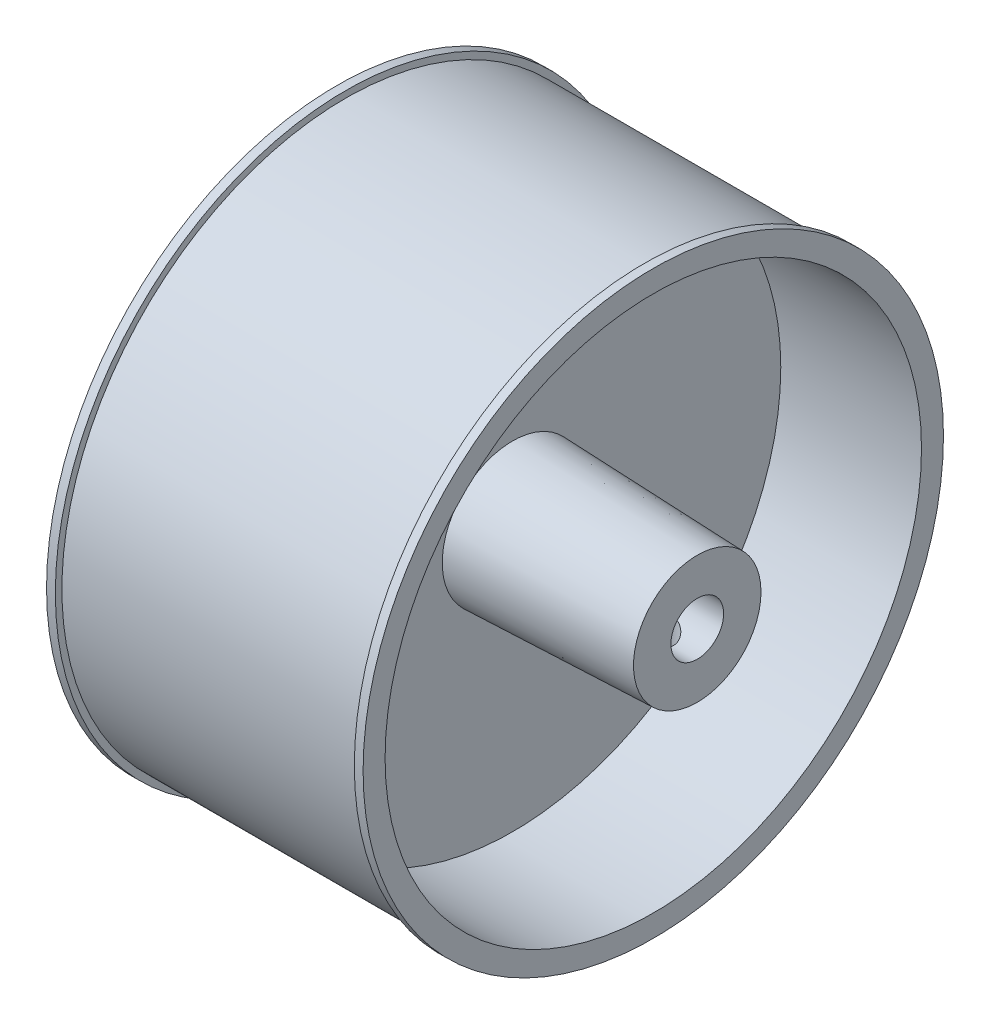
from build123d import *

# Parameters (mm, degrees)
SKETCH1_R               = 33
BOSS_EXTRUDE1_DEPTH     = 36
SKETCH2_R               = 30.5
SKETCH2_R_2             = 8
SKETCH2_R_3             = 3
CUT_EXTRUDE2_DEPTH      = 16
SKETCH6_R               = 7.25
SKETCH5_R               = 8
CUT_EXTRUDE3_START      = -18
SKETCH7_R               = 30.5
CUT_EXTRUDE3_DEPTH      = 18
SKETCH8_R               = 3
CUT_EXTRUDE4_DEPTH      = 77
CUT_EXTRUDE5_DEPTH      = 17
CUT_EXTRUDE5_DEPTH_BACK = 17
SKETCH9_R               = 42.905856896
SKETCH9_R_2             = 32.25
SKETCH10_R              = 2
CUT_EXTRUDE6_DEPTH      = 17


with BuildPart() as part:
    # Sketch1 → Boss-Extrude1 (new body)
    with BuildSketch(Plane(origin=(0, 0, 0), x_dir=(0, 0, -1), z_dir=(1, 0, 0))):
        Circle(SKETCH1_R)
    extrude(amount=BOSS_EXTRUDE1_DEPTH)

    # Sketch2 → Cut-Extrude2 (cut)
    # profile 1 of 3: a face of its own
    with BuildSketch(Plane(origin=(36, 0, 0), x_dir=(0, 0, -1), z_dir=(1, 0, 0))):
        Circle(SKETCH2_R)
        Circle(SKETCH2_R_2, mode=Mode.SUBTRACT)
    # profile 2 of 3: a face of its own
    with BuildSketch(Plane(origin=(36, 0, 0), x_dir=(0, 0, -1), z_dir=(1, 0, 0))):
        Circle(SKETCH2_R_2)
        Circle(SKETCH2_R_3, mode=Mode.SUBTRACT)
    # profile 3 of 3: a face of its own
    with BuildSketch(Plane(origin=(36, 0, 0), x_dir=(0, 0, -1), z_dir=(1, 0, 0))):
        Circle(SKETCH2_R_3)
    extrude(amount=-CUT_EXTRUDE2_DEPTH, mode=Mode.SUBTRACT)

    # Sketch6 → Loft2 section 0
    with BuildSketch(Plane(origin=(41, 0, 0), x_dir=(0, 0, -1), z_dir=(1, 0, 0))):
        Circle(SKETCH6_R)
    # Sketch5 → Loft2 section 1
    with BuildSketch(Plane(origin=(20, 0, 0), x_dir=(0, 0, -1), z_dir=(1, 0, 0))):
        Circle(SKETCH5_R)
    loft()

    # Sketch7 → Cut-Extrude3 (cut)
    with BuildSketch(Plane.ZY.offset(CUT_EXTRUDE3_START)):
        with Locations(Location((0, 0, 0), (0, 0, 180))):
            Circle(SKETCH7_R)
    extrude(amount=CUT_EXTRUDE3_DEPTH, mode=Mode.SUBTRACT)

    # Sketch8 → Cut-Extrude4 (cut)
    with BuildSketch(Plane(origin=(41, 0, 0), x_dir=(0, 0, -1), z_dir=(1, 0, 0))):
        Circle(SKETCH8_R)
    extrude(amount=-CUT_EXTRUDE4_DEPTH, mode=Mode.SUBTRACT)

    # Sketch9 → Cut-Extrude5 (cut, two sides: drawn at the far end of the back side and taken through both)
    with BuildSketch(Plane(origin=(18, 0, 0), x_dir=(0, 0, -1), z_dir=(1, 0, 0)).offset(-CUT_EXTRUDE5_DEPTH_BACK)):
        Circle(SKETCH9_R)
        Circle(SKETCH9_R_2, mode=Mode.SUBTRACT)
    extrude(amount=CUT_EXTRUDE5_DEPTH + CUT_EXTRUDE5_DEPTH_BACK, mode=Mode.SUBTRACT)

    # Sketch10 → Cut-Extrude6 (cut)
    with BuildSketch(Plane(origin=(0, 0, 0), x_dir=(1, 0, 0), z_dir=(0, 1, 0))):
        with Locations(Location((36.300187477, 0, 0), (0, 0, 270))):
            Circle(SKETCH10_R)
    extrude(amount=-CUT_EXTRUDE6_DEPTH, mode=Mode.SUBTRACT)


solid = part.part
